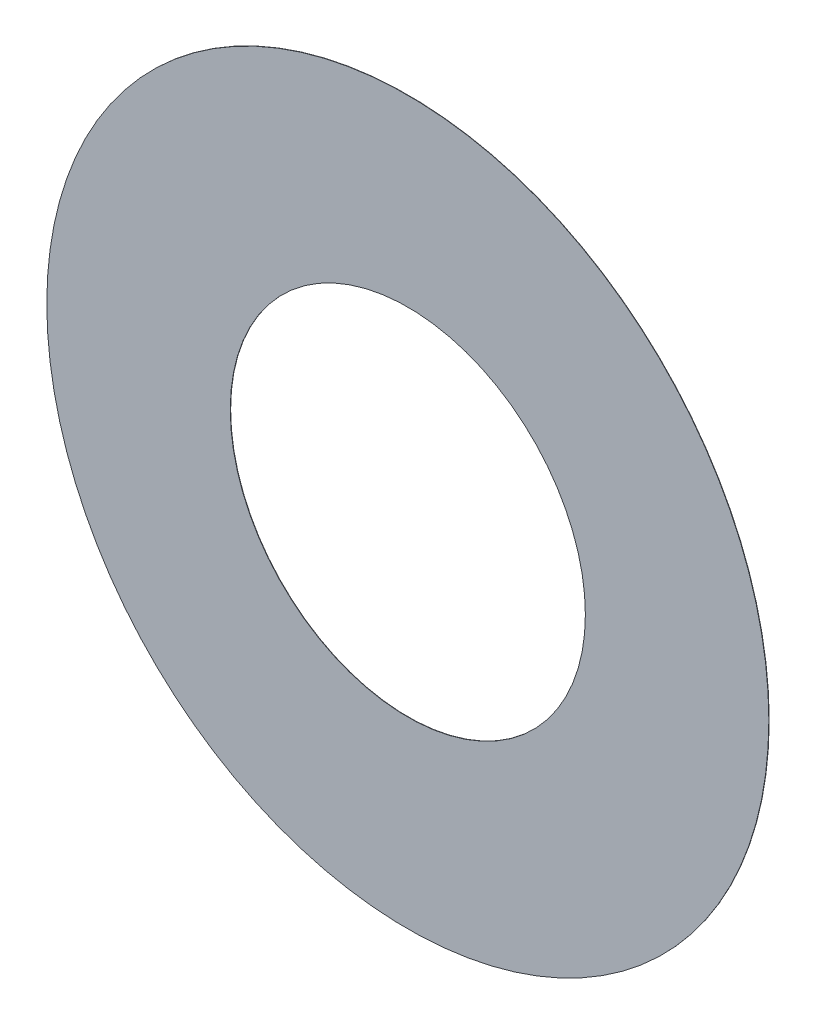
from build123d import *

# Parameters (mm, degrees)
SKETCH1_R           = 77.47
SKETCH1_R_2         = 38.1
BOSS_EXTRUDE1_DEPTH = 0.0762


with BuildPart() as part:
    # Sketch1 → Boss-Extrude1 (new body)
    with BuildSketch(Plane.XY):
        with Locations(Location((0, 0, 0), (0, 0, 180))):
            Circle(SKETCH1_R)
        with Locations(Location((0, 0, 0), (0, 0, 180))):
            Circle(SKETCH1_R_2, mode=Mode.SUBTRACT)
    extrude(amount=BOSS_EXTRUDE1_DEPTH)


solid = part.part
